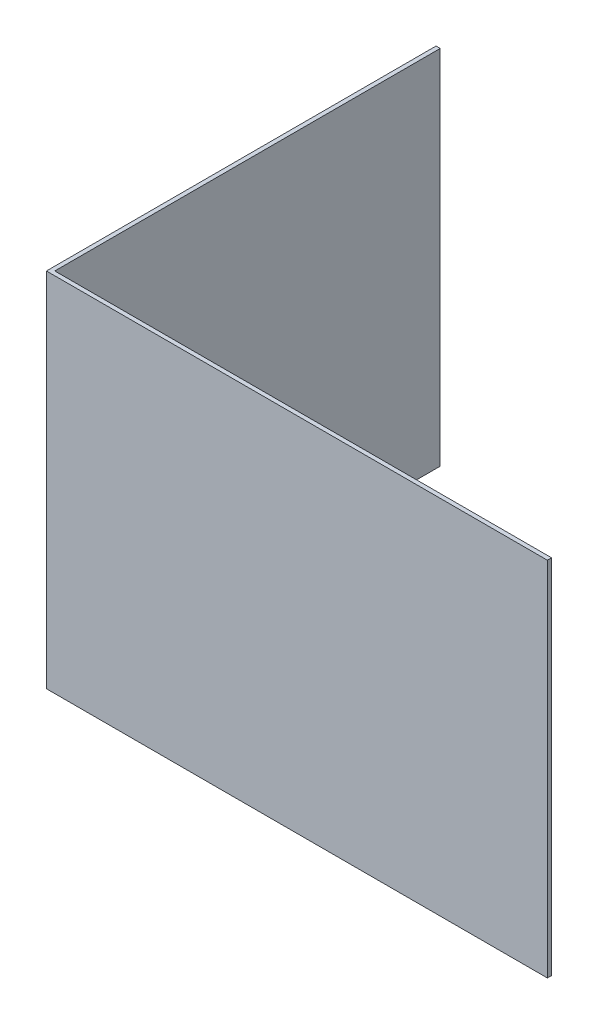
from build123d import *

# Parameters (mm, degrees)
BOSS_EXTRUDE2_DEPTH = 130


with BuildPart() as part:
    # Sketch3 → Boss-Extrude2 (new body)
    with BuildSketch(Plane(origin=(0, 0, 0), x_dir=(1, 0, 0), z_dir=(0, 1, 0))):
        Polygon((-49.265991256, 15.465845713), (-49.265991256, -124.534154287), (130.734008744, -124.534154287), (130.734008744, -123.034154287), (-47.765991256, -123.034154287), (-47.765991256, 15.465845713), align=None)
    extrude(amount=BOSS_EXTRUDE2_DEPTH)


solid = part.part
